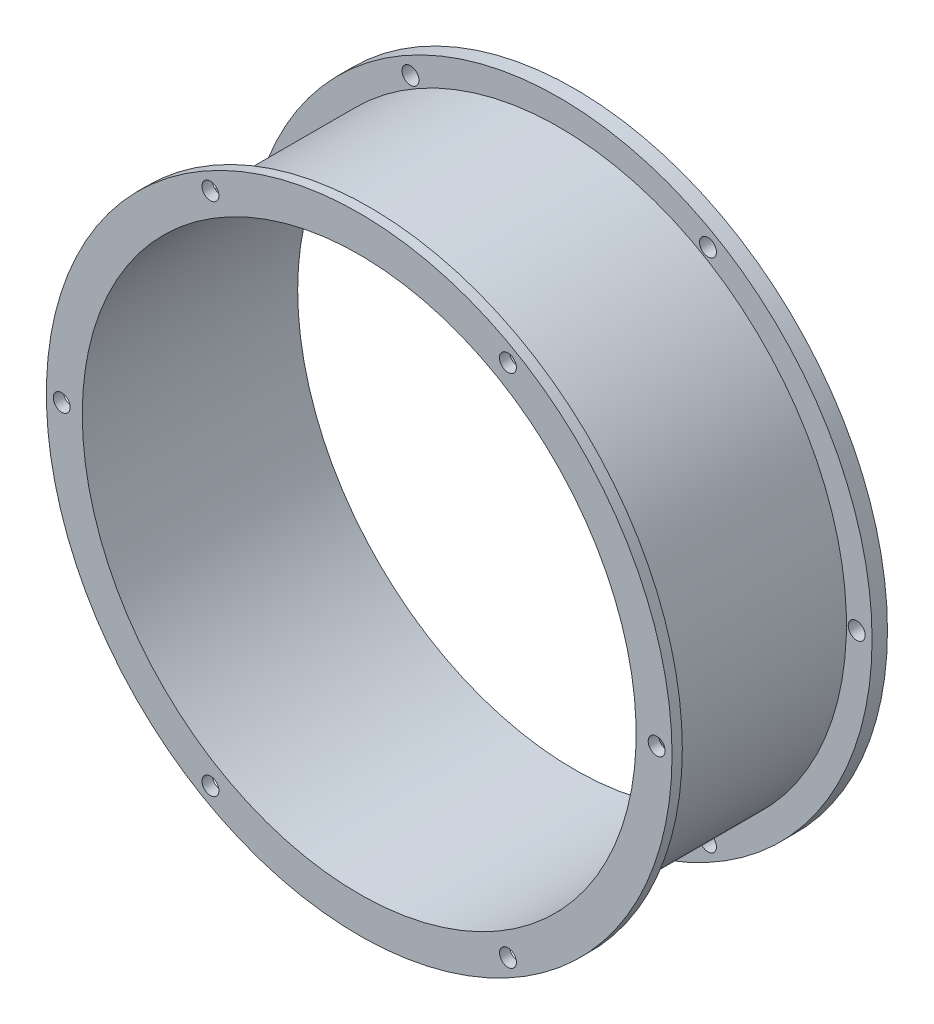
from build123d import *

# Parameters (mm, degrees)
JACKET_START        = -27
SKETCH_1_R          = 56
SKETCH_1_R_2        = 54
JACKET_DEPTH        = 42
REAR_FLANGE_START   = -27
SKETCH_2_R          = 61
SKETCH_2_R_2        = 54
REAR_FLANGE_DEPTH   = 3
FRONT_FLANGE_START  = 13
SKETCH_3_R          = 61
SKETCH_3_R_2        = 54
FRONT_FLANGE_DEPTH  = 2
SKETCH_4_R          = 1.65
THROUGH_HOLES_DEPTH = 100


with BuildPart() as part:
    # Эскиз1 → Jacket (new body)
    with BuildSketch(Plane.XY.offset(JACKET_START)):
        with Locations(Location((0, 0, 0), (0, 0, 180))):
            Circle(SKETCH_1_R)
        with Locations(Location((0, 0, 0), (0, 0, 180))):
            Circle(SKETCH_1_R_2, mode=Mode.SUBTRACT)
    extrude(amount=JACKET_DEPTH)

    # Эскиз2 → Rear_flange (add)
    with BuildSketch(Plane.XY.offset(REAR_FLANGE_START)):
        Circle(SKETCH_2_R)
        with Locations(Location((0, 0, 0), (0, 0, 180))):
            Circle(SKETCH_2_R_2, mode=Mode.SUBTRACT)
    extrude(amount=REAR_FLANGE_DEPTH)

    # Эскиз3 → Front_flange (add)
    with BuildSketch(Plane.XY.offset(FRONT_FLANGE_START)):
        Circle(SKETCH_3_R)
        with Locations(Location((0, 0, 0), (0, 0, 180))):
            Circle(SKETCH_3_R_2, mode=Mode.SUBTRACT)
    extrude(amount=FRONT_FLANGE_DEPTH)

    # Эскиз4 → Through_holes (cut, symmetric)
    with BuildSketch(Plane.XY):
        with Locations((58, 0)):
            Circle(SKETCH_4_R)
        with Locations((29, 50.229473419)):
            Circle(SKETCH_4_R)
        with Locations((-29, 50.229473419)):
            Circle(SKETCH_4_R)
        with Locations((-58, 0)):
            Circle(SKETCH_4_R)
        with Locations((-29, -50.229473419)):
            Circle(SKETCH_4_R)
        with Locations((29, -50.229473419)):
            Circle(SKETCH_4_R)
    extrude(amount=THROUGH_HOLES_DEPTH, both=True, mode=Mode.SUBTRACT)


solid = part.part
